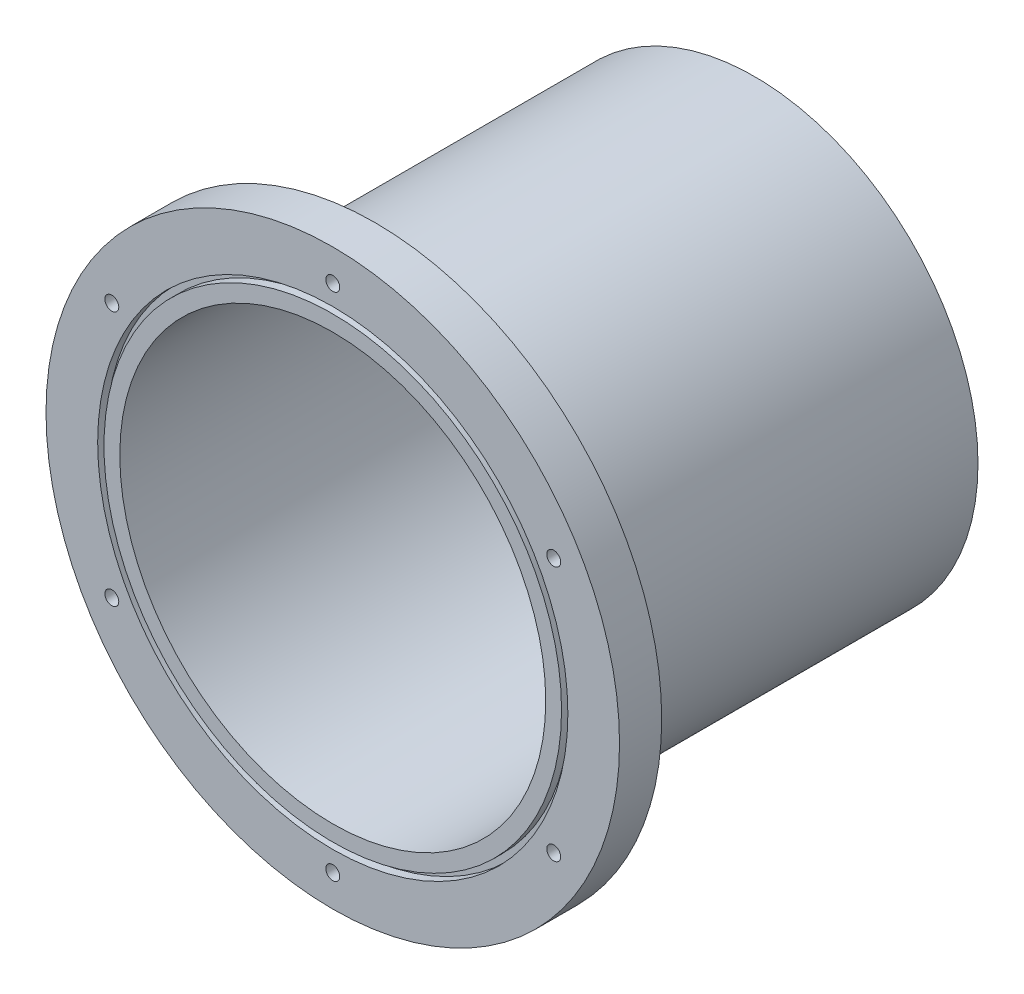
from build123d import *

# Parameters (mm, degrees)
SKETCH1_R           = 106
SKETCH1_R_2         = 101
BOSS_EXTRUDE1_DEPTH = 200
BOSS_EXTRUDE3_START = -20
SKETCH3_R           = 136
SKETCH3_R_2         = 106
BOSS_EXTRUDE3_DEPTH = 20
SKETCH5_R           = 111.5
SKETCH5_R_2         = 108.5
CUT_EXTRUDE1_DEPTH  = 4
SKETCH4_R           = 3.3
CUT_EXTRUDE2_DEPTH  = 33
CIRPATTERN1_COUNT   = 6


with BuildPart() as part:
    # Sketch1 → Boss-Extrude1 (new body)
    with BuildSketch(Plane.XY):
        Circle(SKETCH1_R)
        Circle(SKETCH1_R_2, mode=Mode.SUBTRACT)
    extrude(amount=BOSS_EXTRUDE1_DEPTH)

    # Sketch3 → Boss-Extrude3 (add)
    with BuildSketch(Plane.XY.offset(200).offset(BOSS_EXTRUDE3_START)):
        Circle(SKETCH3_R)
        Circle(SKETCH3_R_2, mode=Mode.SUBTRACT)
    extrude(amount=BOSS_EXTRUDE3_DEPTH)

    # Sketch5 → Cut-Extrude1 (cut)
    with BuildSketch(Plane.XY.offset(200)):
        Circle(SKETCH5_R)
        Circle(SKETCH5_R_2, mode=Mode.SUBTRACT)
    extrude(amount=-CUT_EXTRUDE1_DEPTH, mode=Mode.SUBTRACT)

    # Sketch4 → Cut-Extrude2 (cut)
    with BuildSketch(Plane.XY.offset(200)):
        with Locations((0, 121)):
            Circle(SKETCH4_R)
    cut_extrude2 = extrude(amount=-CUT_EXTRUDE2_DEPTH, mode=Mode.SUBTRACT)

    # CirPattern1: Cut-Extrude2 ×6 about axis
    cirpattern1_axis = Axis((0, 0, 0), (0, 0, 1))
    for i in range(1, CIRPATTERN1_COUNT):
        add(cut_extrude2.rotate(cirpattern1_axis, i * 360 / CIRPATTERN1_COUNT), mode=Mode.SUBTRACT)


solid = part.part
